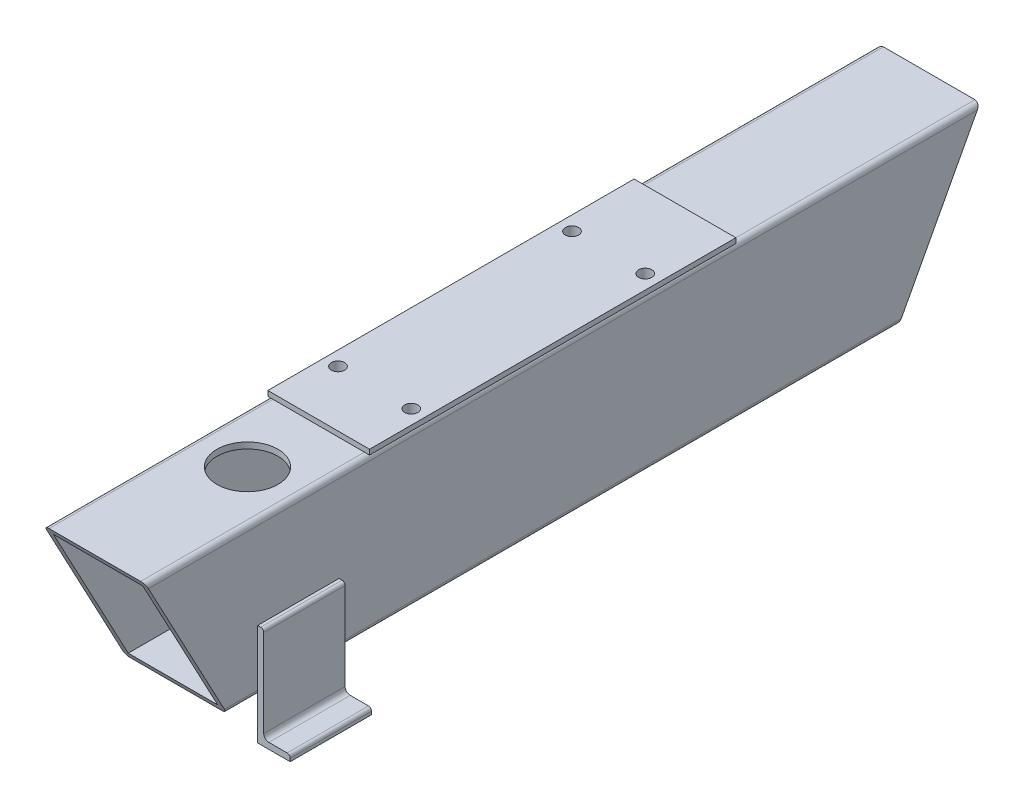
from build123d import *

# Parameters (mm, degrees)
SCHIZZO1_W                = 88
SCHIZZO1_H                = 138
ESTRUSIONE_SOTTILE1_DEPTH = 1000
ESTRUSIONE1_DEPTH         = 1017.120071645
ESTRUSIONE2_DEPTH         = 1017.120071645
SCHIZZO4_R                = 30
ESTRUSIONE3_DEPTH         = 1017.120071645
SCHIZZO7_W                = 100
SCHIZZO7_H                = 360
ESTRUSIONE6_DEPTH         = 5
SCHIZZO6_R                = 6.5
ESTRUSIONE5_DEPTH         = 1017.870198206
ESTRUSIONE7_DEPTH         = 40
ESTRUSIONE7_DEPTH_BACK    = 40


with BuildPart() as part:
    # Schizzo1 → Estrusione-Sottile1 (new body)
    with BuildSketch(Plane.XY):
        with BuildLine():
            Line((5, 0), (95, 0))
            ThreePointArc((95, 0), (98.535533906, 1.464466094), (100, 5))
            Line((100, 5), (100, 145))
            ThreePointArc((100, 145), (98.535533906, 148.535533906), (95, 150))
            Line((95, 150), (5, 150))
            ThreePointArc((5, 150), (1.464466094, 148.535533906), (0, 145))
            Line((0, 145), (0, 5))
            ThreePointArc((0, 5), (1.464466094, 1.464466094), (5, 0))
        make_face()
        with Locations((50, 75)):
            Rectangle(SCHIZZO1_W, SCHIZZO1_H, mode=Mode.SUBTRACT)
    extrude(amount=ESTRUSIONE_SOTTILE1_DEPTH)

    # Schizzo2 → Estrusione1 (cut, through all)
    with BuildSketch(Plane(origin=(100, 0, 0), x_dir=(0, 0, -1), z_dir=(1, 0, 0))):
        Polygon((-920, 0), (-1000, 150), (-1000, 0), align=None)
    extrude(amount=-ESTRUSIONE1_DEPTH, mode=Mode.SUBTRACT)

    # Schizzo3 → Estrusione2 (cut, through all)
    with BuildSketch(Plane(origin=(100, 0, 0), x_dir=(0, 0, -1), z_dir=(1, 0, 0))):
        Polygon((-180, 150), (-260, 0), (0, 0), (0, 150), align=None)
    extrude(amount=-ESTRUSIONE2_DEPTH, mode=Mode.SUBTRACT)

    # Schizzo4 → Estrusione3 (cut, through all)
    with BuildSketch(Plane.XZ):
        with Locations(Location((50, 850, 0), (0, 0, 270))):
            Circle(SCHIZZO4_R)
    extrude(amount=-ESTRUSIONE3_DEPTH, mode=Mode.SUBTRACT)

    # Schizzo7 → Estrusione6 (add)
    with BuildSketch(Plane(origin=(0, 150, 0), x_dir=(1, 0, 0), z_dir=(0, 1, 0))):
        with Locations((50, -600)):
            Rectangle(SCHIZZO7_W, SCHIZZO7_H)
    extrude(amount=ESTRUSIONE6_DEPTH)

    # Schizzo6 → Estrusione5 (cut, through all)
    with BuildSketch(Plane.XZ):
        with Locations(Location((14, 725, 0), (0, 0, 270))):
            Circle(SCHIZZO6_R)
        with Locations(Location((14, 495, 0), (0, 0, 270))):
            Circle(SCHIZZO6_R)
        with Locations(Location((86, 495, 0), (0, 0, 270))):
            Circle(SCHIZZO6_R)
        with Locations(Location((86, 725, 0), (0, 0, 270))):
            Circle(SCHIZZO6_R)
    extrude(amount=-ESTRUSIONE5_DEPTH, mode=Mode.SUBTRACT)

    # Schizzo9 → Estrusione7 (add, two sides: drawn at the far end of the back side and taken through both)
    with BuildSketch(Plane.XY.offset(850).offset(-ESTRUSIONE7_DEPTH_BACK)):
        with BuildLine():
            Line((100, 60), (100, -40))
            Line((100, -40), (132, -40))
            Line((132, -40), (132, -37))
            ThreePointArc((132, -37), (131.121320344, -34.878679656), (129, -34))
            Line((129, -34), (111, -34))
            ThreePointArc((111, -34), (107.464466094, -32.535533906), (106, -29))
            Line((106, -29), (106, 57))
            ThreePointArc((106, 57), (105.121320344, 59.121320344), (103, 60))
            Line((103, 60), (100, 60))
        make_face()
    extrude(amount=ESTRUSIONE7_DEPTH + ESTRUSIONE7_DEPTH_BACK)


solid = part.part
